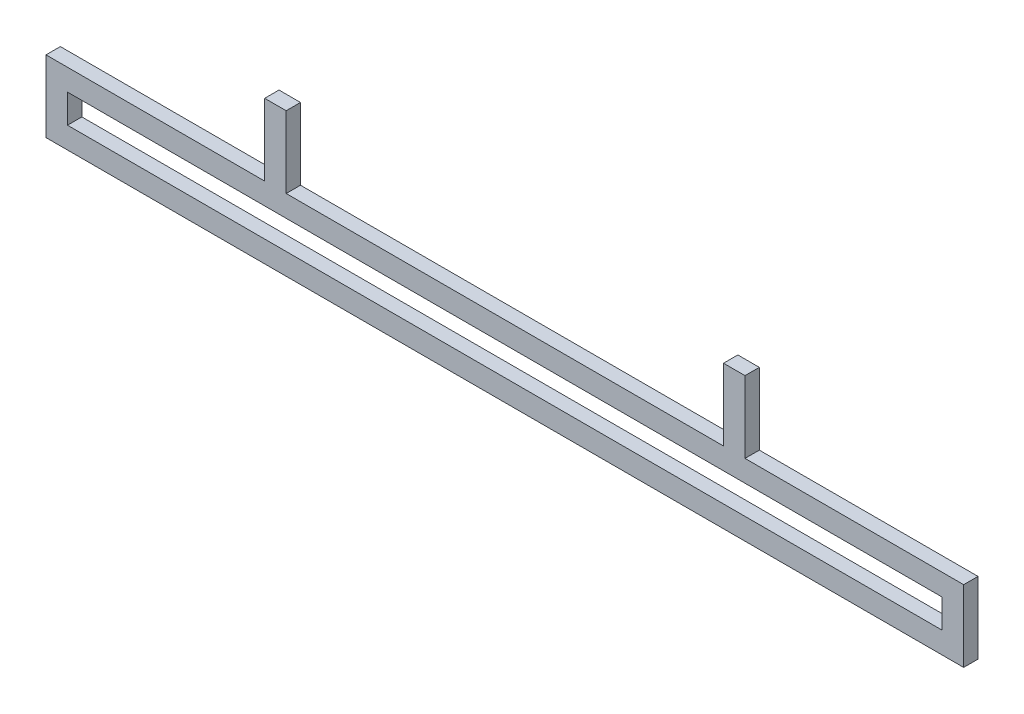
from build123d import *

# Parameters (mm, degrees)
SKETCH1_W           = 640
SKETCH1_H           = 50
BOSS_EXTRUDE1_DEPTH = 10
SKETCH2_W           = 15
SKETCH2_H           = 50
BOSS_EXTRUDE2_DEPTH = 10
SKETCH3_W           = 610
SKETCH3_H           = 20
CUT_EXTRUDE1_DEPTH  = 10


with BuildPart() as part:
    # Sketch1 → Boss-Extrude1 (new body)
    with BuildSketch(Plane.XY):
        with Locations((-320, -120.36)):
            Rectangle(SKETCH1_W, SKETCH1_H)
    extrude(amount=BOSS_EXTRUDE1_DEPTH)

    # Sketch2 → Boss-Extrude2 (add)
    with BuildSketch(Plane.XY):
        with Locations((-160, -70.36)):
            Rectangle(SKETCH2_W, SKETCH2_H)
        with Locations((-480, -70.36)):
            Rectangle(SKETCH2_W, SKETCH2_H)
    extrude(amount=BOSS_EXTRUDE2_DEPTH)

    # Sketch3 → Cut-Extrude1 (cut)
    with BuildSketch(Plane(origin=(0, 0, 0), x_dir=(-1, 0, 0), z_dir=(0, 0, -1))):
        with Locations((320, -120.36)):
            Rectangle(SKETCH3_W, SKETCH3_H)
    extrude(amount=-CUT_EXTRUDE1_DEPTH, mode=Mode.SUBTRACT)


solid = part.part
